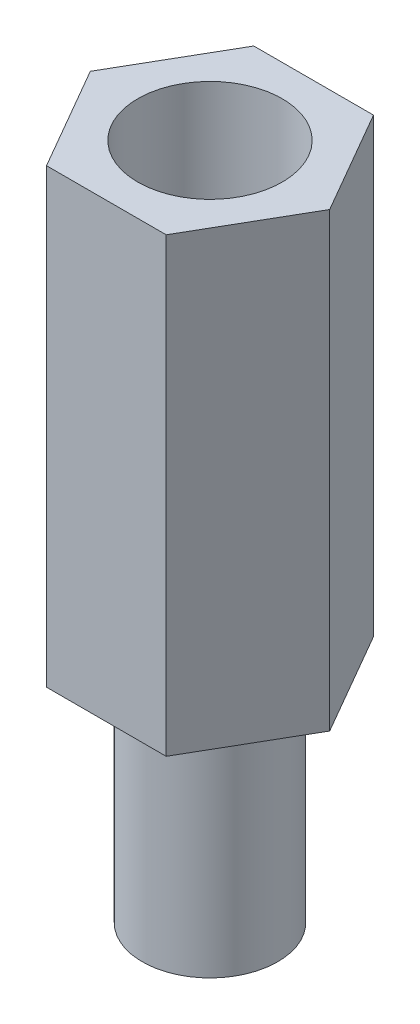
from build123d import *

# Parameters (mm, degrees)
BOSS_EXTRUDE1_DEPTH = 10
SKETCH2_R           = 1.6
CUT_EXTRUDE1_DEPTH  = 5
SKETCH3_R           = 1.5
BOSS_EXTRUDE2_DEPTH = 5


with BuildPart() as part:
    # Sketch1 → Boss-Extrude1 (new body)
    with BuildSketch(Plane(origin=(0, 0, 0), x_dir=(1, 0, 0), z_dir=(0, 1, 0))):
        Polygon((2.65, 0), (1.325, 2.29496732), (-1.325, 2.29496732), (-2.65, 0), (-1.325, -2.29496732), (1.325, -2.29496732), align=None)
    extrude(amount=BOSS_EXTRUDE1_DEPTH)

    # Sketch2 → Cut-Extrude1 (cut)
    with BuildSketch(Plane(origin=(0, 10, 0), x_dir=(1, 0, 0), z_dir=(0, 1, 0))):
        with Locations(Location((0, 0, 0), (0, 0, 270))):
            Circle(SKETCH2_R)
    extrude(amount=-CUT_EXTRUDE1_DEPTH, mode=Mode.SUBTRACT)

    # Sketch3 → Boss-Extrude2 (add)
    with BuildSketch(Plane.XZ):
        with Locations(Location((0, 0, 0), (0, 0, 270))):
            Circle(SKETCH3_R)
    extrude(amount=BOSS_EXTRUDE2_DEPTH)


solid = part.part
